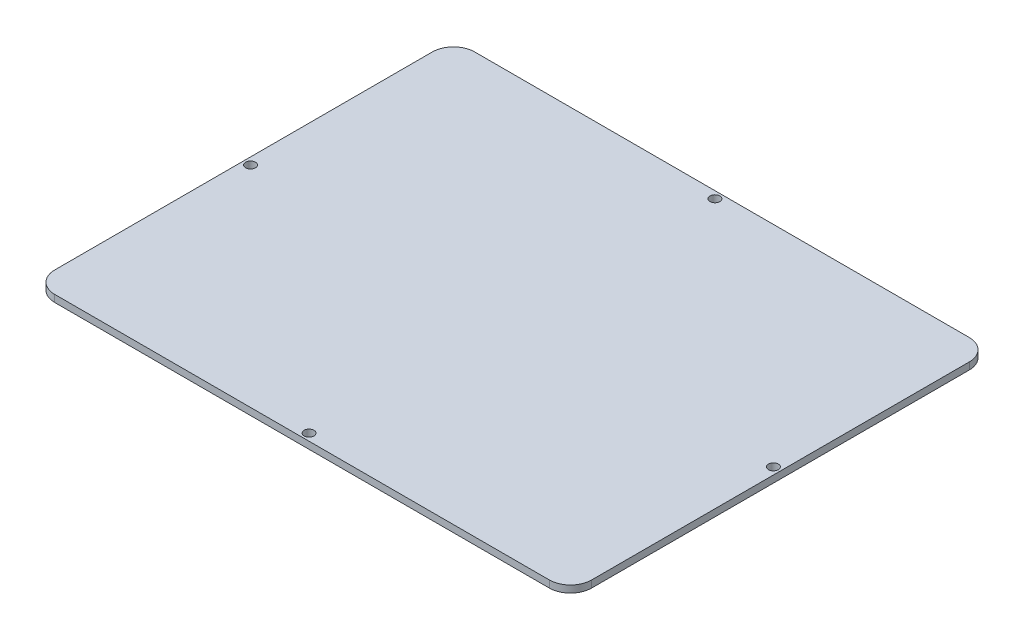
from build123d import *

# Parameters (mm, degrees)
SKETCH1_R           = 1.4
BOSS_EXTRUDE1_DEPTH = 2


with BuildPart() as part:
    # Sketch1 → Boss-Extrude1 (new body)
    with BuildSketch(Plane(origin=(0, 0, 0), x_dir=(1, 0, 0), z_dir=(0, 1, 0))):
        with BuildLine():
            Line((76.2, -53.6), (76.2, 53.6))
            ThreePointArc((76.2, 53.6), (74.442640687, 57.842640687), (70.2, 59.6))
            Line((70.2, 59.6), (-70.2, 59.6))
            ThreePointArc((-70.2, 59.6), (-74.442640687, 57.842640687), (-76.2, 53.6))
            Line((-76.2, 53.6), (-76.2, -53.6))
            ThreePointArc((-76.2, -53.6), (-74.442640687, -57.842640687), (-70.2, -59.6))
            Line((-70.2, -59.6), (70.2, -59.6))
            ThreePointArc((70.2, -59.6), (74.442640687, -57.842640687), (76.2, -53.6))
        make_face()
        with Locations(Location((0, -57.6, 0), (0, 0, 270))):
            Circle(SKETCH1_R, mode=Mode.SUBTRACT)
        with Locations(Location((74.2, 0, 0), (0, 0, 270))):
            Circle(SKETCH1_R, mode=Mode.SUBTRACT)
        with Locations(Location((0, 57.6, 0), (0, 0, 270))):
            Circle(SKETCH1_R, mode=Mode.SUBTRACT)
        with Locations(Location((-74.2, 0, 0), (0, 0, 270))):
            Circle(SKETCH1_R, mode=Mode.SUBTRACT)
    extrude(amount=BOSS_EXTRUDE1_DEPTH)


solid = part.part
